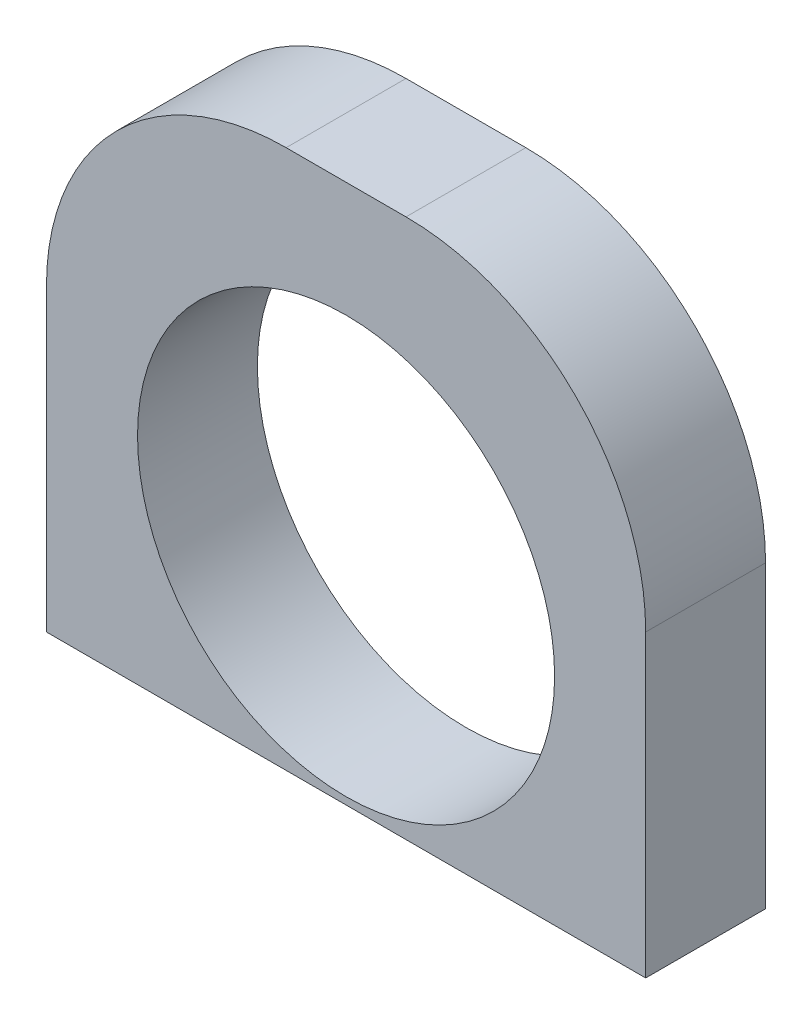
from build123d import *

# Parameters (mm, degrees)
SKETCH1_R           = 11.049
BOSS_EXTRUDE3_DEPTH = 6.35


with BuildPart() as part:
    # Sketch1 → Boss-Extrude3 (new body)
    with BuildSketch(Plane.XY):
        with BuildLine():
            Line((-15.875, -14.2875), (15.875, -14.2875))
            Line((15.875, -14.2875), (15.875, 1.5875))
            ThreePointArc((15.875, 1.5875), (12.155256121, 10.567756121), (3.175, 14.2875))
            Line((3.175, 14.2875), (-3.175, 14.2875))
            ThreePointArc((-3.175, 14.2875), (-12.155256121, 10.567756121), (-15.875, 1.5875))
            Line((-15.875, 1.5875), (-15.875, -14.2875))
        make_face()
        with Locations((0, -2.8575)):
            Circle(SKETCH1_R, mode=Mode.SUBTRACT)
    extrude(amount=BOSS_EXTRUDE3_DEPTH)


solid = part.part
